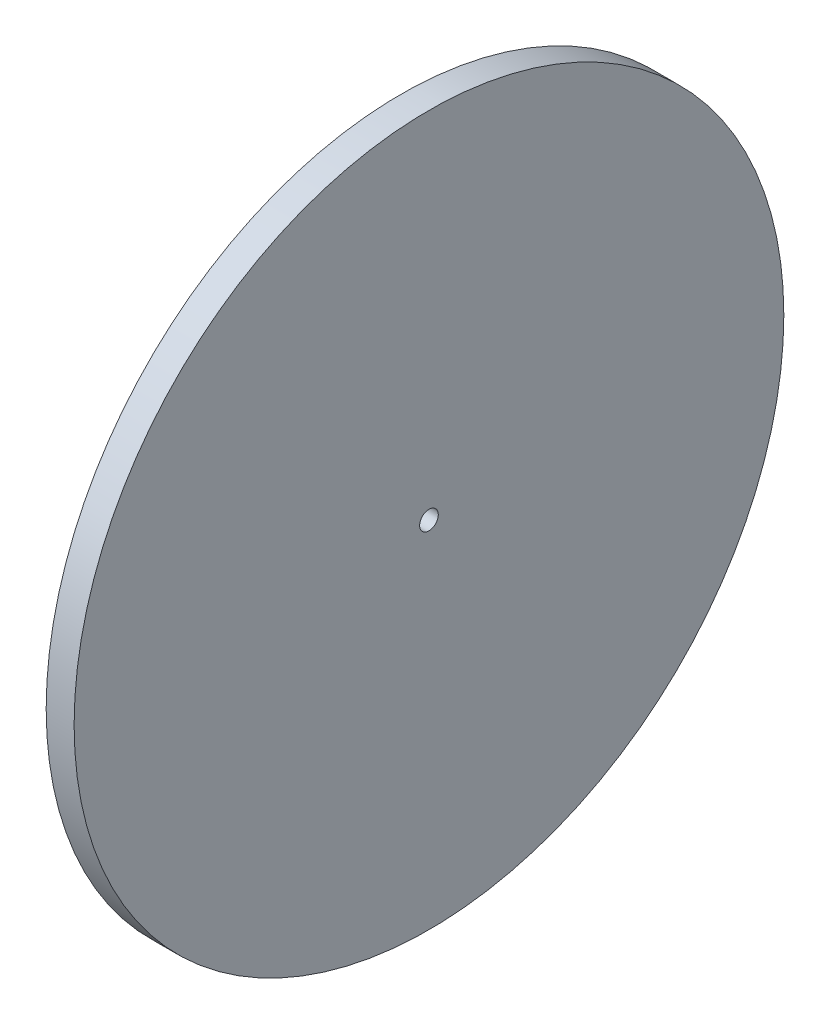
from build123d import *


with BuildPart() as part:
    # Sketch1 → Revolve1 (revolve)
    with BuildSketch(Plane.XY, mode=Mode.PRIVATE) as revolve1_sk:
        with BuildLine():
            Line((0, 2), (3, 2))
            Line((3, 2), (3, 76.2))
            Line((3, 76.2), (-1.5364108, 76.2))
            Line((-1.5364108, 76.2), (-3, 76.2))
            Line((-3, 76.2), (-3, 62))
            ThreePointArc((-3, 62), (-3.585786438, 60.585786438), (-5, 60))
            Line((-5, 60), (-12, 60))
            Line((-12, 60), (-12, 57))
            Line((-12, 57), (0, 57))
            Line((0, 57), (0, 2))
        make_face()
    revolve(revolve1_sk.sketch.rotate(Axis((0, 0, 0), (1, 0, 0)), 90), axis=Axis((0, 0, 0), (1, 0, 0)))


solid = part.part
